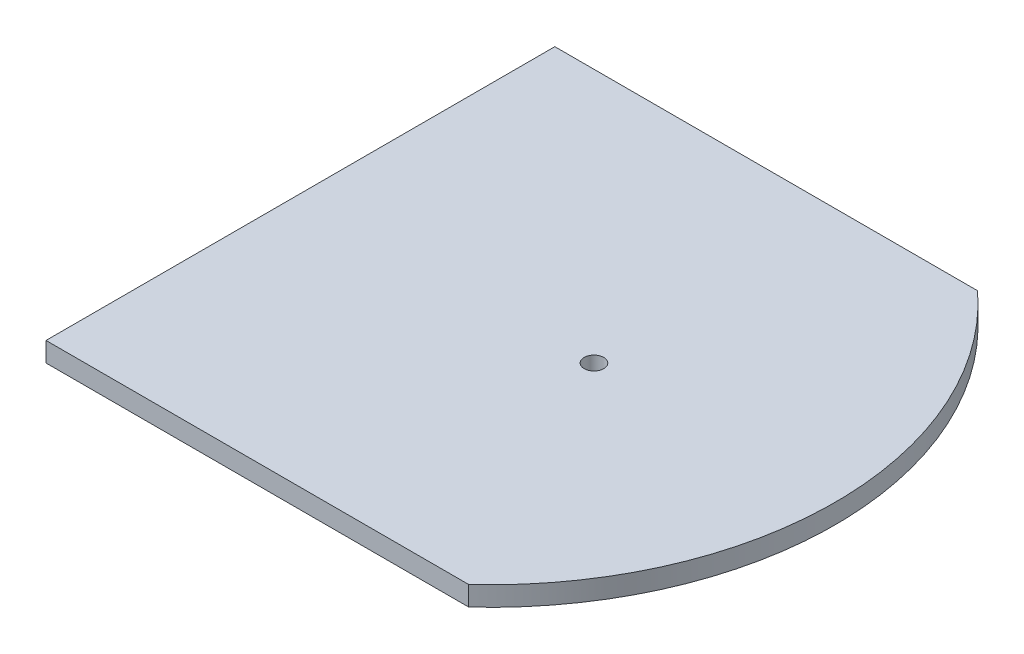
from build123d import *

# Parameters (mm, degrees)
SKETCH1_R           = 2.5
BOSS_EXTRUDE1_DEPTH = 5


with BuildPart() as part:
    # Sketch1 → Boss-Extrude1 (new body)
    with BuildSketch(Plane(origin=(0, 0, 0), x_dir=(1, 0, 0), z_dir=(0, 1, 0))):
        with BuildLine():
            Line((0, 0), (108, 0))
            ThreePointArc((108, 0), (136.62558544, -65), (108, -130))
            Line((108, -130), (0, -130))
            Line((0, -130), (0, 0))
        make_face()
        with Locations(Location((75, -65, 0), (0, 0, 270))):
            Circle(SKETCH1_R, mode=Mode.SUBTRACT)
    extrude(amount=BOSS_EXTRUDE1_DEPTH)


solid = part.part
